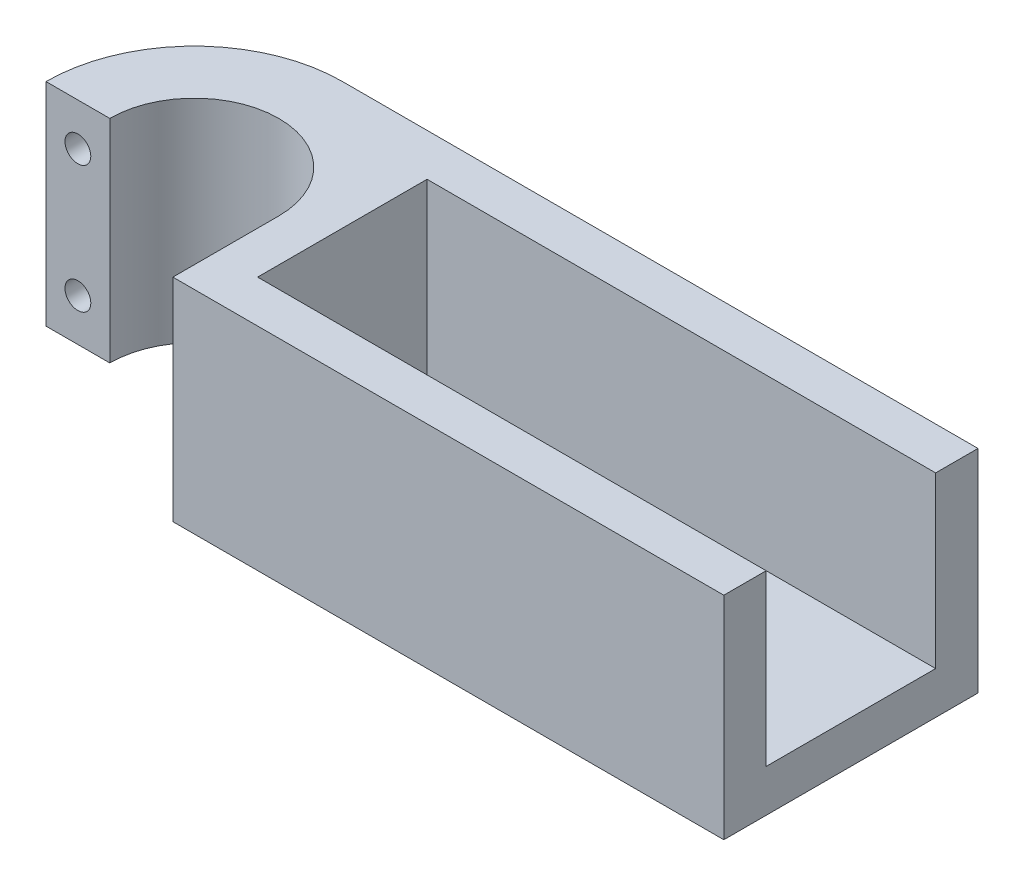
from build123d import *

# Parameters (mm, degrees)
BOSS_EXTRUDE1_DEPTH = 50
SKETCH3_R           = 3.05
CUT_EXTRUDE1_DEPTH  = 7.5
SKETCH4_R           = 5.25
CUT_EXTRUDE2_DEPTH  = 50
SKETCH5_W           = 148.528027858
SKETCH5_H           = 40
CUT_EXTRUDE3_DEPTH  = 40


with BuildPart() as part:
    # Sketch2 → Boss-Extrude1 (new body)
    with BuildSketch(Plane(origin=(0, 0, 0), x_dir=(1, 0, 0), z_dir=(0, 1, 0))):
        with BuildLine():
            Line((-75, 30), (75, 30))
            Line((75, 30), (75, -30))
            Line((75, -30), (-55.05, -30))
            Line((-55.05, -30), (-55.05, -5))
            ThreePointArc((-55.05, -5), (-75, 14.95), (-94.95, -5))
            Line((-94.95, -5), (-110, -5))
            ThreePointArc((-110, -5), (-99.748737342, 19.748737342), (-75, 30))
        make_face()
    extrude(amount=BOSS_EXTRUDE1_DEPTH)

    # Sketch3 → Cut-Extrude1 (cut)
    with BuildSketch(Plane.XY.offset(5)):
        with Locations((-102.475, 40)):
            Circle(SKETCH3_R)
        with Locations((-102.475, 10)):
            Circle(SKETCH3_R)
    extrude(amount=-CUT_EXTRUDE1_DEPTH, mode=Mode.SUBTRACT)

    # Sketch4 → Cut-Extrude2 (cut)
    with BuildSketch(Plane.XY.offset(-2.5)):
        with Locations((-102.475, 40)):
            Circle(SKETCH4_R)
        with Locations((-102.475, 10)):
            Circle(SKETCH4_R)
    extrude(amount=-CUT_EXTRUDE2_DEPTH, mode=Mode.SUBTRACT)

    # Sketch5 → Cut-Extrude3 (cut)
    with BuildSketch(Plane(origin=(0, 50, 0), x_dir=(1, 0, 0), z_dir=(0, 1, 0))):
        with Locations((29.214013929, 0)):
            Rectangle(SKETCH5_W, SKETCH5_H)
    extrude(amount=-CUT_EXTRUDE3_DEPTH, mode=Mode.SUBTRACT)


solid = part.part
